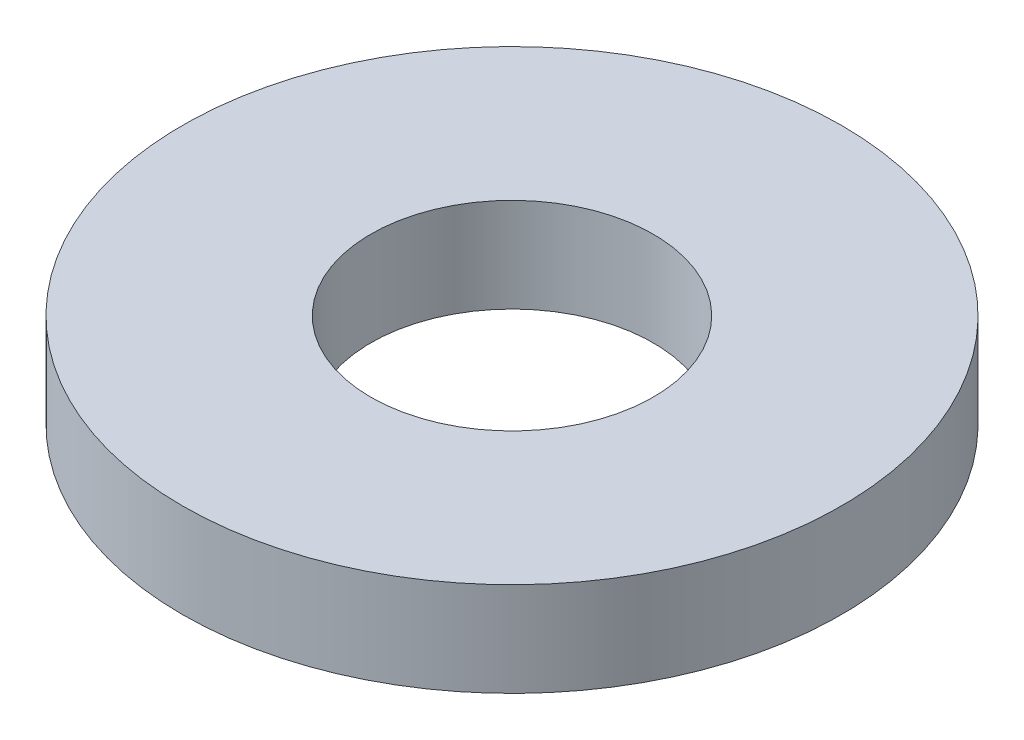
from build123d import *

# Parameters (mm, degrees)
SKETCH_1_R      = 7
SKETCH_1_R_2    = 3
EXTRUDE_1_DEPTH = 2


with BuildPart() as part:
    # 草图1 → 凸台-拉伸1 (new body)
    with BuildSketch(Plane(origin=(0, 0, 0), x_dir=(1, 0, 0), z_dir=(0, 1, 0))):
        with Locations(Location((0, 0, 0), (0, 0, 270))):
            Circle(SKETCH_1_R)
        with Locations(Location((0, 0, 0), (0, 0, 270))):
            Circle(SKETCH_1_R_2, mode=Mode.SUBTRACT)
    extrude(amount=EXTRUDE_1_DEPTH)


solid = part.part
